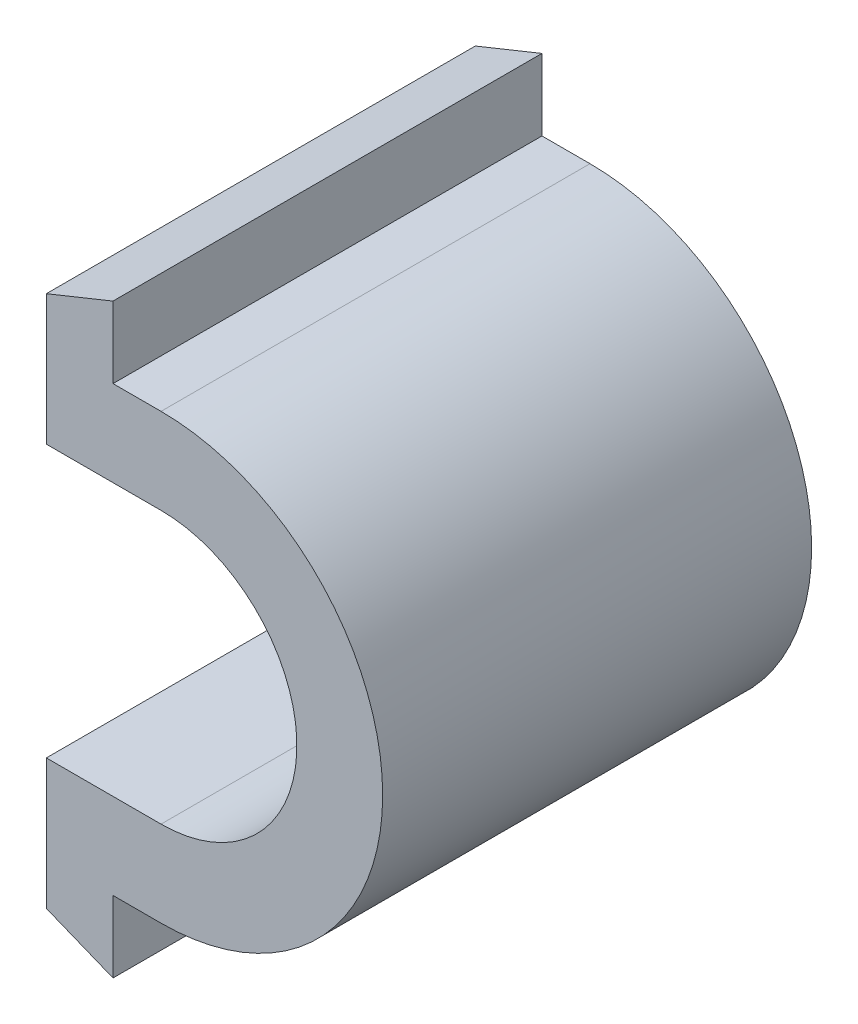
from build123d import *

# Parameters (mm, degrees)
AUFSATZ_LINEAR_AUSTRAGEN1_DEPTH = 6


with BuildPart() as part:
    # Skizze1 → Aufsatz-Linear austragen1 (new body)
    with BuildSketch(Plane.XY):
        with BuildLine():
            Line((0.932336104, 3.1), (1.604162004, 3.1))
            ThreePointArc((1.604162004, 3.1), (4.704162004, 0), (1.604162004, -3.1))
            Line((1.604162004, -3.1), (0.932336104, -3.1))
            Line((0.932336104, -3.1), (0.932336104, -4.1))
            Line((0.932336104, -4.1), (0, -3.723445161))
            Line((0, -3.723445161), (0, -3.356483855))
            Line((0, -3.356483855), (0, -1.9))
            Line((0, -1.9), (1.604162004, -1.9))
            ThreePointArc((1.604162004, -1.9), (3.504162004, 0), (1.604162004, 1.9))
            Line((1.604162004, 1.9), (0, 1.9))
            Line((0, 1.9), (0, 3.356483855))
            Line((0, 3.356483855), (0, 3.723445161))
            Line((0, 3.723445161), (0.932336104, 4.1))
            Line((0.932336104, 4.1), (0.932336104, 3.1))
        make_face()
    extrude(amount=AUFSATZ_LINEAR_AUSTRAGEN1_DEPTH)


solid = part.part
